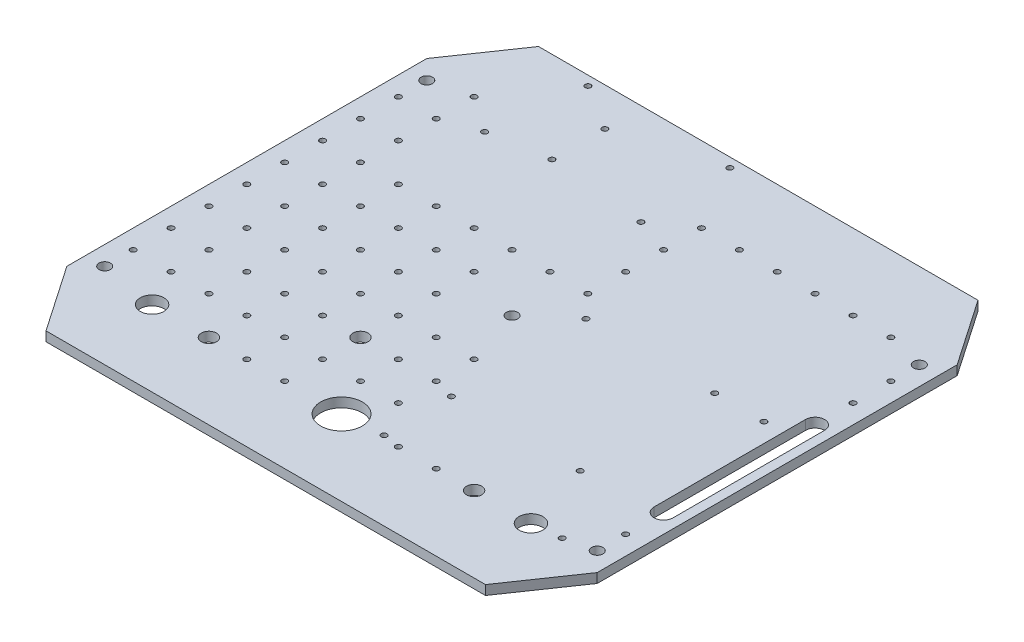
from build123d import *

# Parameters (mm, degrees)
ESQUISSE1_R        = 3
ESQUISSE1_R_2      = 1.5
ESQUISSE1_R_3      = 6.25
ESQUISSE1_R_4      = 4
ESQUISSE1_R_5      = 11
BOSS_EXTRU_1_DEPTH = 5


with BuildPart() as part:
    # Esquisse1 → Boss.-Extru.1 (new body)
    with BuildSketch(Plane(origin=(0, 0, 0), x_dir=(1, 0, 0), z_dir=(0, 1, 0))):
        Polygon((-140, -95), (-140, 95), (-116, 130), (116, 130), (140, 95), (140, -95), (116, -130), (-116, -130), align=None)
        with Locations(Location((-130, 85, 0), (0, 0, 270))):
            Circle(ESQUISSE1_R, mode=Mode.SUBTRACT)
        with Locations(Location((-30, 10, 0), (0, 0, 270))):
            Circle(ESQUISSE1_R_2, mode=Mode.SUBTRACT)
        with Locations(Location((-50, 10, 0), (0, 0, 270))):
            Circle(ESQUISSE1_R_2, mode=Mode.SUBTRACT)
        with Locations(Location((-70, 10, 0), (0, 0, 270))):
            Circle(ESQUISSE1_R_2, mode=Mode.SUBTRACT)
        with Locations(Location((-90, 10, 0), (0, 0, 270))):
            Circle(ESQUISSE1_R_2, mode=Mode.SUBTRACT)
        with Locations(Location((-110, 10, 0), (0, 0, 270))):
            Circle(ESQUISSE1_R_2, mode=Mode.SUBTRACT)
        with Locations(Location((-130, 10, 0), (0, 0, 270))):
            Circle(ESQUISSE1_R_2, mode=Mode.SUBTRACT)
        with Locations(Location((-50, 30, 0), (0, 0, 270))):
            Circle(ESQUISSE1_R_2, mode=Mode.SUBTRACT)
        with Locations(Location((-70, 30, 0), (0, 0, 270))):
            Circle(ESQUISSE1_R_2, mode=Mode.SUBTRACT)
        with Locations(Location((-90, 30, 0), (0, 0, 270))):
            Circle(ESQUISSE1_R_2, mode=Mode.SUBTRACT)
        with Locations(Location((-110, 30, 0), (0, 0, 270))):
            Circle(ESQUISSE1_R_2, mode=Mode.SUBTRACT)
        with Locations(Location((-130, 30, 0), (0, 0, 270))):
            Circle(ESQUISSE1_R_2, mode=Mode.SUBTRACT)
        with Locations(Location((-100, -90, 0), (0, 0, 270))):
            Circle(ESQUISSE1_R_3, mode=Mode.SUBTRACT)
        with Locations(Location((100, -90, 0), (0, 0, 90))):
            Circle(ESQUISSE1_R_3, mode=Mode.SUBTRACT)
        with Locations(Location((-70, -90, 0), (0, 0, 270))):
            Circle(ESQUISSE1_R_4, mode=Mode.SUBTRACT)
        with Locations(Location((-110, 50, 0), (0, 0, 270))):
            Circle(ESQUISSE1_R_2, mode=Mode.SUBTRACT)
        with Locations(Location((-130, 50, 0), (0, 0, 270))):
            Circle(ESQUISSE1_R_2, mode=Mode.SUBTRACT)
        with Locations(Location((-30, -50, 0), (0, 0, 270))):
            Circle(ESQUISSE1_R_4, mode=Mode.SUBTRACT)
        with Locations(Location((70, -90, 0), (0, 0, 270))):
            Circle(ESQUISSE1_R_4, mode=Mode.SUBTRACT)
        with Locations(Location((-110, 70, 0), (0, 0, 270))):
            Circle(ESQUISSE1_R_2, mode=Mode.SUBTRACT)
        with Locations(Location((-130, 70, 0), (0, 0, 270))):
            Circle(ESQUISSE1_R_2, mode=Mode.SUBTRACT)
        with Locations(Location((-110, 90, 0), (0, 0, 270))):
            Circle(ESQUISSE1_R_2, mode=Mode.SUBTRACT)
        with Locations(Location((-30, 30, 0), (0, 0, 270))):
            Circle(ESQUISSE1_R_2, mode=Mode.SUBTRACT)
        with Locations(Location((-10, 30, 0), (0, 0, 270))):
            Circle(ESQUISSE1_R_2, mode=Mode.SUBTRACT)
        with Locations(Location((-10, 125, 0), (0, 0, 270))):
            Circle(ESQUISSE1_R_2, mode=Mode.SUBTRACT)
        with Locations(Location((-10, -70, 0), (0, 0, 90))):
            Circle(ESQUISSE1_R_2, mode=Mode.SUBTRACT)
        with Locations(Location((-10, -50, 0), (0, 0, 90))):
            Circle(ESQUISSE1_R_2, mode=Mode.SUBTRACT)
        with Locations(Location((-10, -30, 0), (0, 0, 90))):
            Circle(ESQUISSE1_R_2, mode=Mode.SUBTRACT)
        with Locations(Location((-30, -90, 0), (0, 0, 90))):
            Circle(ESQUISSE1_R_2, mode=Mode.SUBTRACT)
        with Locations(Location((-30, -70, 0), (0, 0, 90))):
            Circle(ESQUISSE1_R_2, mode=Mode.SUBTRACT)
        with Locations(Location((-30, -30, 0), (0, 0, 90))):
            Circle(ESQUISSE1_R_2, mode=Mode.SUBTRACT)
        with Locations(Location((-84.9, 125, 0), (0, 0, 270))):
            Circle(ESQUISSE1_R_2, mode=Mode.SUBTRACT)
        with Locations(Location((-60.8, 109.8, 0), (0, 0, 270))):
            Circle(ESQUISSE1_R_2, mode=Mode.SUBTRACT)
        with Locations(Location((-50, -90, 0), (0, 0, 90))):
            Circle(ESQUISSE1_R_2, mode=Mode.SUBTRACT)
        with Locations(Location((-130, -70, 0), (0, 0, 90))):
            Circle(ESQUISSE1_R_2, mode=Mode.SUBTRACT)
        with Locations(Location((-110, -70, 0), (0, 0, 90))):
            Circle(ESQUISSE1_R_2, mode=Mode.SUBTRACT)
        with Locations(Location((-90, -70, 0), (0, 0, 90))):
            Circle(ESQUISSE1_R_2, mode=Mode.SUBTRACT)
        with Locations(Location((-70, -70, 0), (0, 0, 90))):
            Circle(ESQUISSE1_R_2, mode=Mode.SUBTRACT)
        with Locations(Location((-50, -70, 0), (0, 0, 90))):
            Circle(ESQUISSE1_R_2, mode=Mode.SUBTRACT)
        with Locations(Location((-130, -50, 0), (0, 0, 90))):
            Circle(ESQUISSE1_R_2, mode=Mode.SUBTRACT)
        with Locations(Location((-110, -50, 0), (0, 0, 90))):
            Circle(ESQUISSE1_R_2, mode=Mode.SUBTRACT)
        with Locations(Location((-90, -50, 0), (0, 0, 90))):
            Circle(ESQUISSE1_R_2, mode=Mode.SUBTRACT)
        with Locations(Location((-70, -50, 0), (0, 0, 90))):
            Circle(ESQUISSE1_R_2, mode=Mode.SUBTRACT)
        with Locations(Location((-50, -50, 0), (0, 0, 90))):
            Circle(ESQUISSE1_R_2, mode=Mode.SUBTRACT)
        with Locations(Location((-130, -30, 0), (0, 0, 90))):
            Circle(ESQUISSE1_R_2, mode=Mode.SUBTRACT)
        with Locations(Location((-110, -30, 0), (0, 0, 90))):
            Circle(ESQUISSE1_R_2, mode=Mode.SUBTRACT)
        with Locations(Location((-90, -30, 0), (0, 0, 90))):
            Circle(ESQUISSE1_R_2, mode=Mode.SUBTRACT)
        with Locations(Location((-70, -30, 0), (0, 0, 90))):
            Circle(ESQUISSE1_R_2, mode=Mode.SUBTRACT)
        with Locations(Location((-50, -30, 0), (0, 0, 90))):
            Circle(ESQUISSE1_R_2, mode=Mode.SUBTRACT)
        with Locations(Location((-130, -10, 0), (0, 0, 90))):
            Circle(ESQUISSE1_R_2, mode=Mode.SUBTRACT)
        with Locations(Location((-110, -10, 0), (0, 0, 90))):
            Circle(ESQUISSE1_R_2, mode=Mode.SUBTRACT)
        with Locations(Location((-90, -10, 0), (0, 0, 90))):
            Circle(ESQUISSE1_R_2, mode=Mode.SUBTRACT)
        with Locations(Location((-70, -10, 0), (0, 0, 90))):
            Circle(ESQUISSE1_R_2, mode=Mode.SUBTRACT)
        with Locations(Location((-50, -10, 0), (0, 0, 90))):
            Circle(ESQUISSE1_R_2, mode=Mode.SUBTRACT)
        with Locations(Location((-30, -10, 0), (0, 0, 90))):
            Circle(ESQUISSE1_R_2, mode=Mode.SUBTRACT)
        with Locations(Location((-130, -85, 0), (0, 0, 90))):
            Circle(ESQUISSE1_R, mode=Mode.SUBTRACT)
        with Locations(Location((130, -85, 0), (0, 0, 270))):
            Circle(ESQUISSE1_R, mode=Mode.SUBTRACT)
        with Locations(Location((21, -88.5, 0), (0, 0, 270))):
            Circle(ESQUISSE1_R_2, mode=Mode.SUBTRACT)
        with Locations(Location((115, -88.5, 0), (0, 0, 270))):
            Circle(ESQUISSE1_R_2, mode=Mode.SUBTRACT)
        with Locations(Location((21, -53, 0), (0, 0, 270))):
            Circle(ESQUISSE1_R_2, mode=Mode.SUBTRACT)
        with Locations(Location((89, -53, 0), (0, 0, 270))):
            Circle(ESQUISSE1_R_2, mode=Mode.SUBTRACT)
        with Locations(Location((21, 18, 0), (0, 0, 270))):
            Circle(ESQUISSE1_R_2, mode=Mode.SUBTRACT)
        with Locations(Location((89, 18, 0), (0, 0, 270))):
            Circle(ESQUISSE1_R_2, mode=Mode.SUBTRACT)
        with Locations(Location((115, 18, 0), (0, 0, 270))):
            Circle(ESQUISSE1_R_2, mode=Mode.SUBTRACT)
        with Locations(Location((0, -90, 0), (0, 0, 270))):
            Circle(ESQUISSE1_R_5, mode=Mode.SUBTRACT)
        with Locations(Location((-60.8, 81.9, 0), (0, 0, 270))):
            Circle(ESQUISSE1_R_2, mode=Mode.SUBTRACT)
        with Locations(Location((-91.22, 76.78, 0), (0, 0, 270))):
            Circle(ESQUISSE1_R_2, mode=Mode.SUBTRACT)
        with Locations(Location((-8.7, 76.78, 0), (0, 0, 270))):
            Circle(ESQUISSE1_R_2, mode=Mode.SUBTRACT)
        with Locations(Location((130, -70, 0), (0, 0, 270))):
            Circle(ESQUISSE1_R_2, mode=Mode.SUBTRACT)
        with Locations(Location((50, -90, 0), (0, 0, 270))):
            Circle(ESQUISSE1_R_2, mode=Mode.SUBTRACT)
        with Locations(Location((30, -90, 0), (0, 0, 270))):
            Circle(ESQUISSE1_R_2, mode=Mode.SUBTRACT)
        with Locations(Location((10, -30, 0), (0, 0, 270))):
            Circle(ESQUISSE1_R_2, mode=Mode.SUBTRACT)
        with Locations(Location((10, -50, 0), (0, 0, 270))):
            Circle(ESQUISSE1_R_2, mode=Mode.SUBTRACT)
        with Locations(Location((10, -70, 0), (0, 0, 270))):
            Circle(ESQUISSE1_R_2, mode=Mode.SUBTRACT)
        with Locations(Location((10, 90, 0), (0, 0, 90))):
            Circle(ESQUISSE1_R_2, mode=Mode.SUBTRACT)
        with Locations(Location((10, 70, 0), (0, 0, 90))):
            Circle(ESQUISSE1_R_2, mode=Mode.SUBTRACT)
        with Locations(Location((10, 50, 0), (0, 0, 90))):
            Circle(ESQUISSE1_R_2, mode=Mode.SUBTRACT)
        with Locations(Location((10, 30, 0), (0, 0, 90))):
            Circle(ESQUISSE1_R_2, mode=Mode.SUBTRACT)
        with Locations(Location((30, 90, 0), (0, 0, 90))):
            Circle(ESQUISSE1_R_2, mode=Mode.SUBTRACT)
        with Locations(Location((110, 90, 0), (0, 0, 90))):
            Circle(ESQUISSE1_R_2, mode=Mode.SUBTRACT)
        with Locations(Location((90, 90, 0), (0, 0, 90))):
            Circle(ESQUISSE1_R_2, mode=Mode.SUBTRACT)
        with Locations(Location((70, 90, 0), (0, 0, 90))):
            Circle(ESQUISSE1_R_2, mode=Mode.SUBTRACT)
        with Locations(Location((50, 90, 0), (0, 0, 90))):
            Circle(ESQUISSE1_R_2, mode=Mode.SUBTRACT)
        with Locations(Location((130, 70, 0), (0, 0, 90))):
            Circle(ESQUISSE1_R_2, mode=Mode.SUBTRACT)
        with Locations(Location((130, 50, 0), (0, 0, 90))):
            Circle(ESQUISSE1_R_2, mode=Mode.SUBTRACT)
        with Locations(Location((130, 85, 0), (0, 0, 90))):
            Circle(ESQUISSE1_R, mode=Mode.SUBTRACT)
        with Locations(Location((0, 0, 0), (0, 0, 270))):
            Circle(ESQUISSE1_R, mode=Mode.SUBTRACT)
        with BuildLine():
            Line((135, 30), (135, -50))
            ThreePointArc((135, -50), (130, -55), (125, -50))
            Line((125, -50), (125, 30))
            ThreePointArc((125, 30), (130, 35), (135, 30))
        make_face(mode=Mode.SUBTRACT)
    extrude(amount=BOSS_EXTRU_1_DEPTH)


solid = part.part
